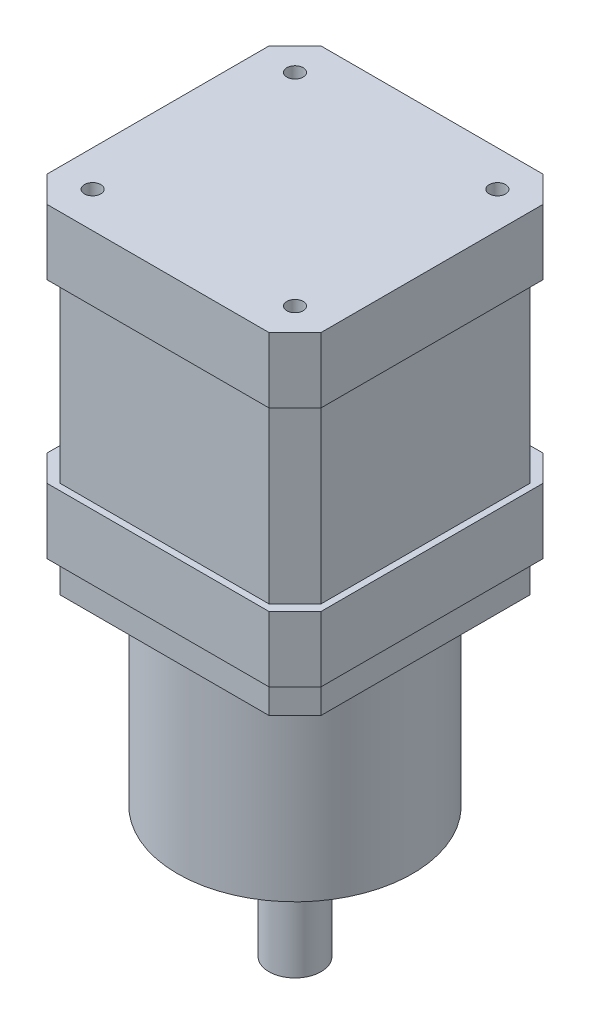
from build123d import *

# Parameters (mm, degrees)
SKETCH1_W               = 42
SKETCH1_H               = 42
BOSS_EXTRUDE1_DEPTH     = 23.5
CUT_EXTRUDE1_START      = -10
SKETCH2_W               = 42
SKETCH2_H               = 42
SKETCH2_W_2             = 40
SKETCH2_H_2             = 40
CUT_EXTRUDE1_DEPTH      = 27
CHAMFER1_SIZE           = 4
CUT_EXTRUDE2_DEPTH      = 56.596762496
CUT_EXTRUDE2_DEPTH_BACK = 56.596762496
SKETCH4_R               = 1.25
BOSS_EXTRUDE2_DEPTH     = 4.8
SKETCH6_R               = 18
BOSS_EXTRUDE3_DEPTH     = 30
SKETCH7_R               = 1.25
CUT_EXTRUDE3_DEPTH      = 4
SKETCH8_R               = 11
BOSS_EXTRUDE4_DEPTH     = 2
SKETCH9_R               = 4
BOSS_EXTRUDE5_DEPTH     = 18
BOSS_EXTRUDE6_START     = -15
BOSS_EXTRUDE6_DEPTH     = 15


with BuildPart() as part:
    # Sketch1 → Boss-Extrude1 (new, symmetric)
    with BuildSketch(Plane(origin=(0, 0, 0), x_dir=(1, 0, 0), z_dir=(0, 1, 0))):
        Rectangle(SKETCH1_W, SKETCH1_H)
    extrude(amount=BOSS_EXTRUDE1_DEPTH, both=True)

    # Sketch2 → Cut-Extrude1 (cut)
    with BuildSketch(Plane(origin=(0, 23.5, 0), x_dir=(1, 0, 0), z_dir=(0, 1, 0)).offset(CUT_EXTRUDE1_START)):
        Rectangle(SKETCH2_W, SKETCH2_H)
        Rectangle(SKETCH2_W_2, SKETCH2_H_2, mode=Mode.SUBTRACT)
    extrude(amount=-CUT_EXTRUDE1_DEPTH, mode=Mode.SUBTRACT)

    # Chamfer1
    chamfer1_edges = [part.edges().sort_by_distance(p)[0] for p in [
        (-21, -18.5, -21),
        (21, -18.5, -21),
        (21, -18.5, 21),
        (-21, -18.5, 21),
        (20, 0, -20),
        (20, 0, 20),
        (-20, 0, 20),
        (-20, 0, -20),
        (-21, 18.5, -21),
        (21, 18.5, -21),
        (21, 18.5, 21),
        (-21, 18.5, 21),
    ]]
    chamfer(chamfer1_edges, length=CHAMFER1_SIZE)

    # Sketch4 → Cut-Extrude2 (cut, two sides: drawn at the far end of the back side and taken through both)
    with BuildSketch(Plane(origin=(0, 23.5, 0), x_dir=(1, 0, 0), z_dir=(0, 1, 0)).offset(-CUT_EXTRUDE2_DEPTH_BACK)):
        with Locations(Location((15.5, 15.5, 0), (0, 0, 270))):
            Circle(SKETCH4_R)
        with Locations(Location((15.5, -15.5, 0), (0, 0, 270))):
            Circle(SKETCH4_R)
        with Locations(Location((-15.5, -15.5, 0), (0, 0, 270))):
            Circle(SKETCH4_R)
        with Locations(Location((-15.5, 15.5, 0), (0, 0, 270))):
            Circle(SKETCH4_R)
    extrude(amount=CUT_EXTRUDE2_DEPTH + CUT_EXTRUDE2_DEPTH_BACK, mode=Mode.SUBTRACT)

    # Sketch5 → Boss-Extrude2 (add)
    with BuildSketch(Plane.XZ.offset(23.5)):
        Polygon((-20, 16), (-16, 20), (16, 20), (20, 16), (20, -16), (16, -20), (-16, -20), (-20, -16), align=None)
    extrude(amount=BOSS_EXTRUDE2_DEPTH)

    # Sketch6 → Boss-Extrude3 (add)
    with BuildSketch(Plane.XZ.offset(28.3)):
        with Locations(Location((0, 0, 0), (0, 0, 270))):
            Circle(SKETCH6_R)
    extrude(amount=BOSS_EXTRUDE3_DEPTH)

    # Sketch7 → Cut-Extrude3 (cut)
    with BuildSketch(Plane.XZ.offset(58.3)):
        with Locations(Location((-9.899494937, 9.899494937, 0), (0, 0, 270))):
            Circle(SKETCH7_R)
        with Locations(Location((9.899494937, 9.899494937, 0), (0, 0, 270))):
            Circle(SKETCH7_R)
        with Locations(Location((9.899494937, -9.899494937, 0), (0, 0, 270))):
            Circle(SKETCH7_R)
        with Locations(Location((-9.899494937, -9.899494937, 0), (0, 0, 270))):
            Circle(SKETCH7_R)
    extrude(amount=-CUT_EXTRUDE3_DEPTH, mode=Mode.SUBTRACT)

    # Sketch8 → Boss-Extrude4 (add)
    with BuildSketch(Plane.XZ.offset(58.3)):
        with Locations(Location((0, 0, 0), (0, 0, 270))):
            Circle(SKETCH8_R)
    extrude(amount=BOSS_EXTRUDE4_DEPTH)

    # Sketch9 → Boss-Extrude5 (add)
    with BuildSketch(Plane.XZ.offset(60.3)):
        with Locations(Location((0, 0, 0), (0, 0, 270))):
            Circle(SKETCH9_R)
    extrude(amount=BOSS_EXTRUDE5_DEPTH)

    # Sketch10 → Boss-Extrude6 (add)
    with BuildSketch(Plane.XZ.offset(78.3).offset(BOSS_EXTRUDE6_START)):
        with BuildLine():
            Line((-2.645751311, 3), (2.645751311, 3))
            ThreePointArc((2.645751311, 3), (0, 4), (-2.645751311, 3))
        make_face()
    extrude(amount=BOSS_EXTRUDE6_DEPTH)


solid = part.part
